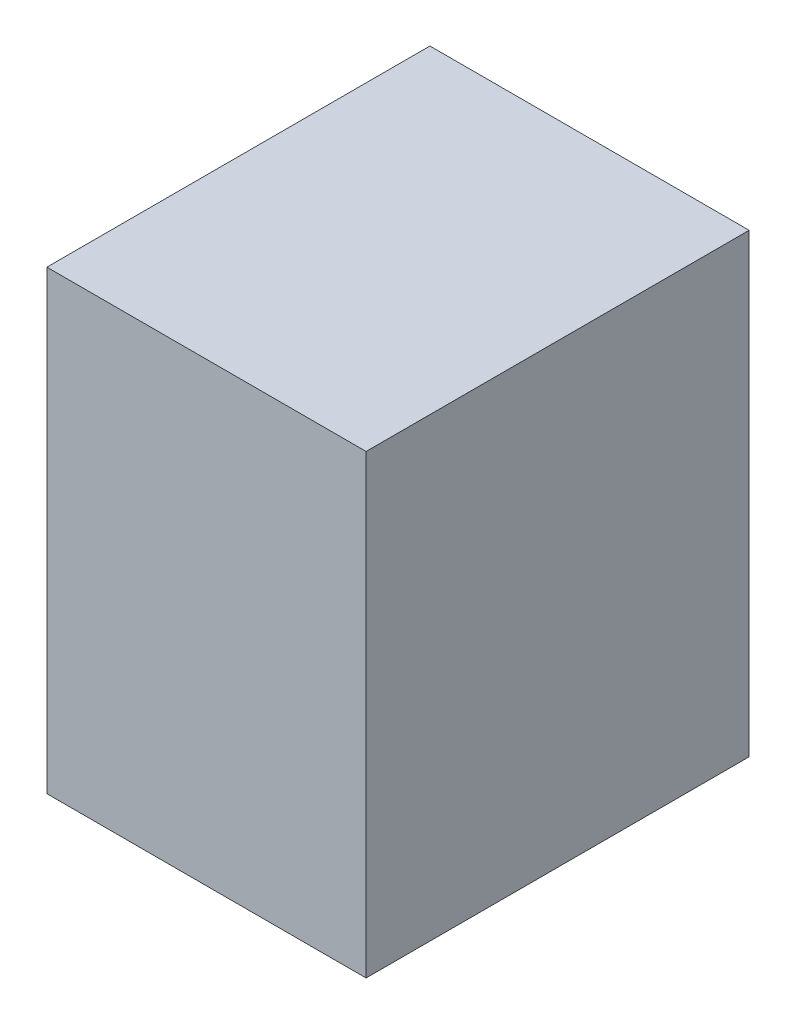
from build123d import *

# Parameters (mm, degrees)
SKETCH1_W           = 17.5
SKETCH1_H           = 21
BOSS_EXTRUDE1_DEPTH = 25


with BuildPart() as part:
    # Sketch1 → Boss-Extrude1 (new body)
    with BuildSketch(Plane(origin=(0, 0, 0), x_dir=(1, 0, 0), z_dir=(0, 1, 0))):
        Rectangle(SKETCH1_W, SKETCH1_H)
    extrude(amount=BOSS_EXTRUDE1_DEPTH)


solid = part.part
